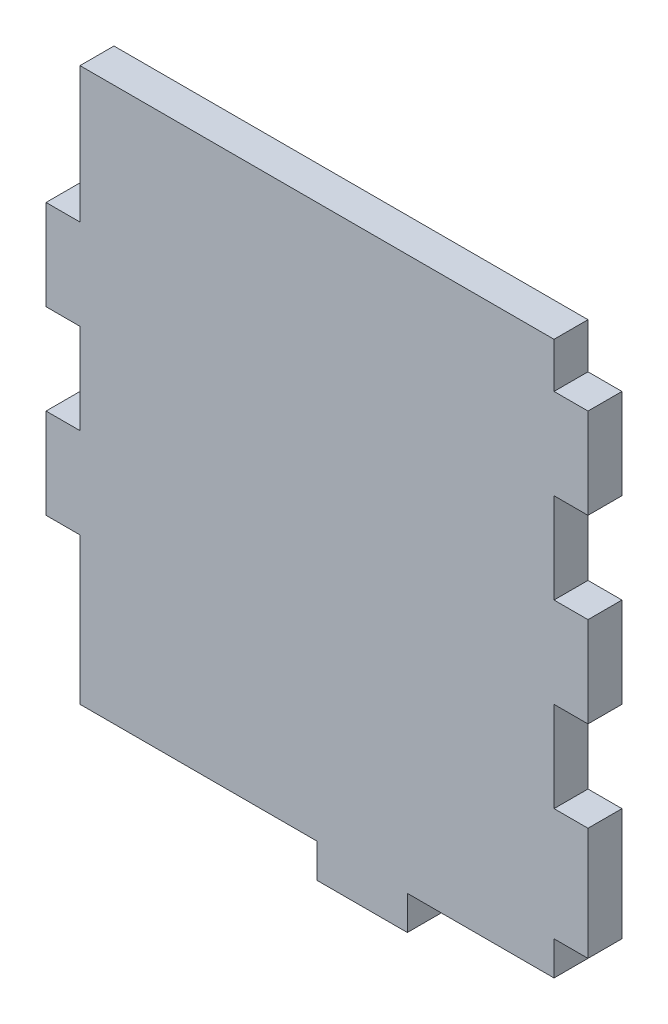
from build123d import *

# Parameters (mm, degrees)
SKETCH2_W           = 76.2
SKETCH2_H           = 82.55
BOSS_EXTRUDE1_DEPTH = 4.7752
SKETCH3_W           = 38.1
SKETCH3_H           = 4.7752
SKETCH3_W_2         = 25.4
CUT_EXTRUDE1_DEPTH  = 4.7752
SKETCH4_W           = 4.7752
SKETCH4_H           = 19.05
SKETCH4_H_2         = 12.7
SKETCH4_H_3         = 20.6248
CUT_EXTRUDE2_DEPTH  = 4.7752
SKETCH5_W           = 4.7752
SKETCH5_H           = 4.7752
SKETCH5_H_2         = 12.7
SKETCH5_H_3         = 6.35
CUT_EXTRUDE3_DEPTH  = 4.7752


with BuildPart() as part:
    # Sketch2 → Boss-Extrude1 (new body)
    with BuildSketch(Plane.XY):
        with Locations((38.1, 41.275)):
            Rectangle(SKETCH2_W, SKETCH2_H)
    extrude(amount=BOSS_EXTRUDE1_DEPTH)

    # Sketch3 → Cut-Extrude1 (cut)
    with BuildSketch(Plane.XY.offset(4.7752)):
        with Locations((19.05, 2.3876)):
            Rectangle(SKETCH3_W, SKETCH3_H)
        with Locations((63.5, 2.3876)):
            Rectangle(SKETCH3_W_2, SKETCH3_H)
    extrude(amount=-CUT_EXTRUDE1_DEPTH, mode=Mode.SUBTRACT)

    # Sketch4 → Cut-Extrude2 (cut)
    with BuildSketch(Plane.XY.offset(4.7752)):
        with Locations((2.3876, 73.025)):
            Rectangle(SKETCH4_W, SKETCH4_H)
        with Locations((2.3876, 44.45)):
            Rectangle(SKETCH4_W, SKETCH4_H_2)
        with Locations((2.3876, 15.0876)):
            Rectangle(SKETCH4_W, SKETCH4_H_3)
    extrude(amount=-CUT_EXTRUDE2_DEPTH, mode=Mode.SUBTRACT)

    # Sketch5 → Cut-Extrude3 (cut)
    with BuildSketch(Plane.XY.offset(4.7752)):
        with Locations((73.8124, 7.1628)):
            Rectangle(SKETCH5_W, SKETCH5_H)
        with Locations((73.8124, 31.75)):
            Rectangle(SKETCH5_W, SKETCH5_H_2)
        with Locations((73.8124, 57.15)):
            Rectangle(SKETCH5_W, SKETCH5_H_2)
        with Locations((73.8124, 79.375)):
            Rectangle(SKETCH5_W, SKETCH5_H_3)
    extrude(amount=-CUT_EXTRUDE3_DEPTH, mode=Mode.SUBTRACT)


solid = part.part
